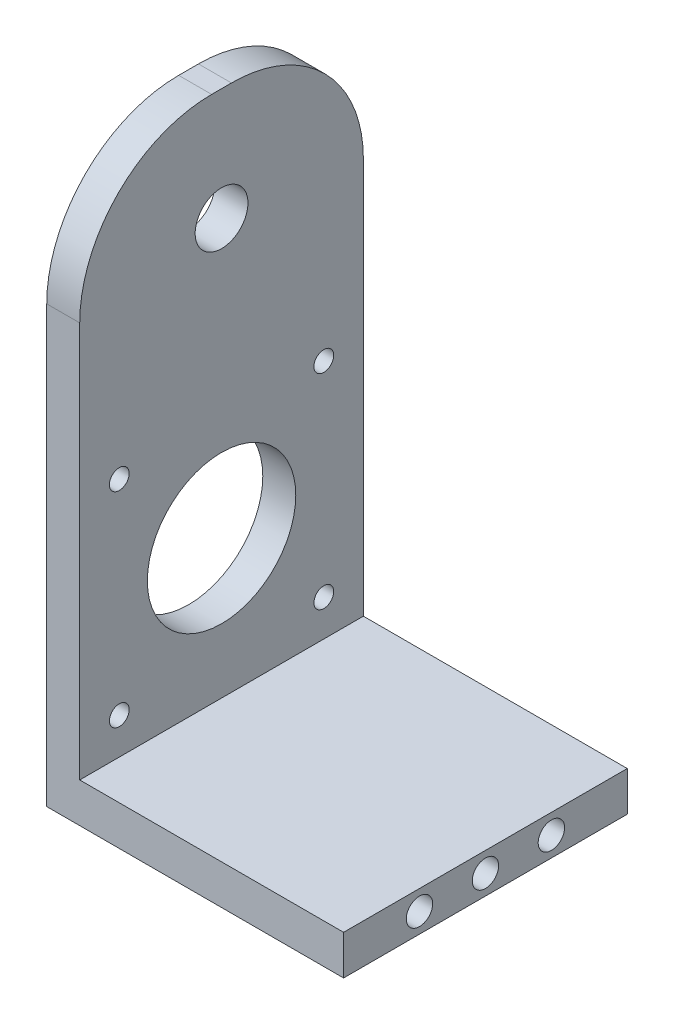
from build123d import *

# Parameters (mm, degrees)
SKETCH1_W           = 45
SKETCH1_H           = 43
BOSS_EXTRUDE1_DEPTH = 6
SKETCH2_W           = 5
SKETCH2_H           = 43
BOSS_EXTRUDE2_DEPTH = 80
CUT_EXTRUDE1_REACH  = 99.254
SKETCH3_R           = 11.25
SKETCH3_R_2         = 1.5
CUT_EXTRUDE2_REACH  = 99.254
SKETCH4_R           = 4
FILLET1_R           = 20
SKETCH6_R           = 2
CUT_EXTRUDE4_DEPTH  = 10


with BuildPart() as part:
    # Sketch1 → Boss-Extrude1 (new body)
    with BuildSketch(Plane(origin=(0, 0, 0), x_dir=(1, 0, 0), z_dir=(0, 1, 0))):
        Rectangle(SKETCH1_W, SKETCH1_H)
    extrude(amount=BOSS_EXTRUDE1_DEPTH)

    # Sketch2 → Boss-Extrude2 (add)
    with BuildSketch(Plane(origin=(0, 6, 0), x_dir=(1, 0, 0), z_dir=(0, 1, 0))):
        with Locations((-20, 0)):
            Rectangle(SKETCH2_W, SKETCH2_H)
    extrude(amount=BOSS_EXTRUDE2_DEPTH)

    # Sketch3 → Cut-Extrude1 (cut, up to next)
    with BuildSketch(Plane(origin=(-17.5, 0, 0), x_dir=(0, 0, -1), z_dir=(1, 0, 0)), mode=Mode.PRIVATE) as cut_extrude1_sk1:
        with Locations((0, 27)):
            Circle(SKETCH3_R)
    cut_extrude1_tool1 = extrude(cut_extrude1_sk1.sketch, amount=-CUT_EXTRUDE1_REACH, mode=Mode.PRIVATE) & part.part
    # Sketch3 → Cut-Extrude1 (cut, up to next)
    with BuildSketch(Plane(origin=(-17.5, 0, 0), x_dir=(0, 0, -1), z_dir=(1, 0, 0)), mode=Mode.PRIVATE) as cut_extrude1_sk2:
        with Locations((-15.5, 42.5)):
            Circle(SKETCH3_R_2)
    cut_extrude1_tool2 = extrude(cut_extrude1_sk2.sketch, amount=-CUT_EXTRUDE1_REACH, mode=Mode.PRIVATE) & part.part
    # Sketch3 → Cut-Extrude1 (cut, up to next)
    with BuildSketch(Plane(origin=(-17.5, 0, 0), x_dir=(0, 0, -1), z_dir=(1, 0, 0)), mode=Mode.PRIVATE) as cut_extrude1_sk3:
        with Locations((15.5, 42.5)):
            Circle(SKETCH3_R_2)
    cut_extrude1_tool3 = extrude(cut_extrude1_sk3.sketch, amount=-CUT_EXTRUDE1_REACH, mode=Mode.PRIVATE) & part.part
    # Sketch3 → Cut-Extrude1 (cut, up to next)
    with BuildSketch(Plane(origin=(-17.5, 0, 0), x_dir=(0, 0, -1), z_dir=(1, 0, 0)), mode=Mode.PRIVATE) as cut_extrude1_sk4:
        with Locations((15.5, 11.5)):
            Circle(SKETCH3_R_2)
    cut_extrude1_tool4 = extrude(cut_extrude1_sk4.sketch, amount=-CUT_EXTRUDE1_REACH, mode=Mode.PRIVATE) & part.part
    # Sketch3 → Cut-Extrude1 (cut, up to next)
    with BuildSketch(Plane(origin=(-17.5, 0, 0), x_dir=(0, 0, -1), z_dir=(1, 0, 0)), mode=Mode.PRIVATE) as cut_extrude1_sk5:
        with Locations((-15.5, 11.5)):
            Circle(SKETCH3_R_2)
    cut_extrude1_tool5 = extrude(cut_extrude1_sk5.sketch, amount=-CUT_EXTRUDE1_REACH, mode=Mode.PRIVATE) & part.part
    add(cut_extrude1_tool1.solids().sort_by_distance((-17.5, 27, 0))[0], mode=Mode.SUBTRACT)
    add(cut_extrude1_tool2.solids().sort_by_distance((-17.5, 42.5, 15.5))[0], mode=Mode.SUBTRACT)
    add(cut_extrude1_tool3.solids().sort_by_distance((-17.5, 42.5, -15.5))[0], mode=Mode.SUBTRACT)
    add(cut_extrude1_tool4.solids().sort_by_distance((-17.5, 11.5, -15.5))[0], mode=Mode.SUBTRACT)
    add(cut_extrude1_tool5.solids().sort_by_distance((-17.5, 11.5, 15.5))[0], mode=Mode.SUBTRACT)

    # Sketch4 → Cut-Extrude2 (cut, up to next)
    with BuildSketch(Plane(origin=(-17.5, 0, 0), x_dir=(0, 0, -1), z_dir=(1, 0, 0)), mode=Mode.PRIVATE) as cut_extrude2_sk1:
        with Locations((0, 69)):
            Circle(SKETCH4_R)
    cut_extrude2_tool1 = extrude(cut_extrude2_sk1.sketch, amount=-CUT_EXTRUDE2_REACH, mode=Mode.PRIVATE) & part.part
    add(cut_extrude2_tool1.solids().sort_by_distance((-17.5, 69, 0))[0], mode=Mode.SUBTRACT)

    # Fillet1
    fillet1_edges = [part.edges().sort_by_distance(p)[0] for p in [
        (-20, 86, -21.5),
        (-20, 86, 21.5),
    ]]
    fillet(fillet1_edges, radius=FILLET1_R)

    # Sketch6 → Cut-Extrude4 (cut)
    with BuildSketch(Plane(origin=(22.5, 0, 0), x_dir=(0, 0, -1), z_dir=(1, 0, 0))):
        with Locations((0, 3)):
            Circle(SKETCH6_R)
        with Locations((10, 3)):
            Circle(SKETCH6_R)
        with Locations((-10, 3)):
            Circle(SKETCH6_R)
    extrude(amount=-CUT_EXTRUDE4_DEPTH, mode=Mode.SUBTRACT)


solid = part.part
